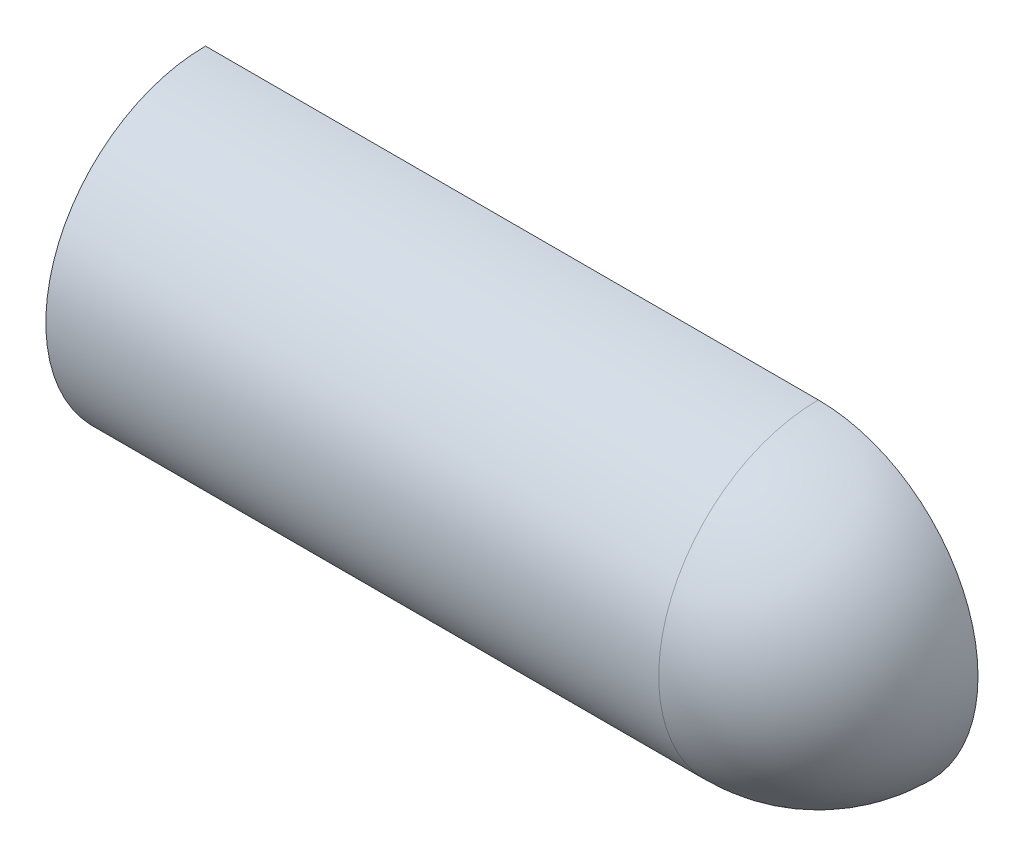
from build123d import *

# Parameters (mm, degrees)
REVOLVE1_ANGLE = 180


with BuildPart() as part:
    # Sketch2 → Revolve1 (revolve)
    with BuildSketch(Plane.XY):
        with BuildLine():
            Line((26, 0), (31, 0))
            ThreePointArc((31, 0), (21.920310217, 21.920310217), (0, 31))
            Line((0, 31), (-119, 31))
            Line((-119, 31), (-119, 26))
            Line((-119, 26), (0, 26))
            ThreePointArc((0, 26), (18.384776311, 18.384776311), (26, 0))
        make_face()
    revolve(axis=Axis((26, 0, 0), (1, 0, 0)), revolution_arc=REVOLVE1_ANGLE)


solid = part.part
